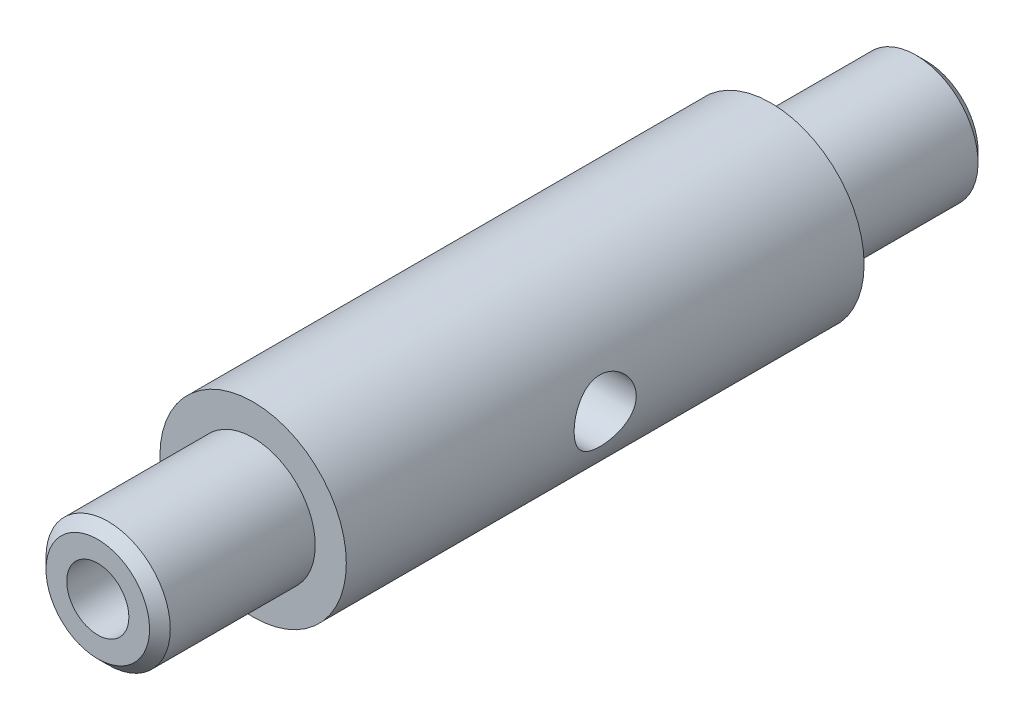
from build123d import *

# Parameters (mm, degrees)
HOLE1_D                 = 6
HOLE1_DEPTH             = 45
CUT_EXTRUDE1_DEPTH      = 82.006172604
CUT_EXTRUDE1_DEPTH_BACK = 82.006172604
SKETCH4_R               = 3
CHAMFER1_SIZE           = 1


with BuildPart() as part:
    # Sketch1 → Revolve1 (revolve)
    with BuildSketch(Plane(origin=(0, 0, 0), x_dir=(0, 0, -1), z_dir=(1, 0, 0))):
        Polygon((0, 0), (0, 6), (15, 6), (15, 9), (65, 9), (65, 6), (80, 6), (80, 0), align=None)
    revolve(axis=Axis((0, 0, -80), (0, 0, 1)))

    # Hole1
    with Locations(Plane.XY):
        with Locations((0, 0)):
            Hole(HOLE1_D / 2, depth=HOLE1_DEPTH)

    # Sketch4 → Cut-Extrude1 (cut, two sides: drawn at the far end of the back side and taken through both)
    with BuildSketch(Plane(origin=(0, 0, 0), x_dir=(0, 0, -1), z_dir=(1, 0, 0)).offset(-CUT_EXTRUDE1_DEPTH_BACK)):
        with Locations((40, 0)):
            Circle(SKETCH4_R)
    extrude(amount=CUT_EXTRUDE1_DEPTH + CUT_EXTRUDE1_DEPTH_BACK, mode=Mode.SUBTRACT)

    # Chamfer1
    chamfer1_edges = [part.edges().sort_by_distance(p)[0] for p in [
        (0, -6, -80),
        (0, -6, 0),
    ]]
    chamfer(chamfer1_edges, length=CHAMFER1_SIZE)


solid = part.part
